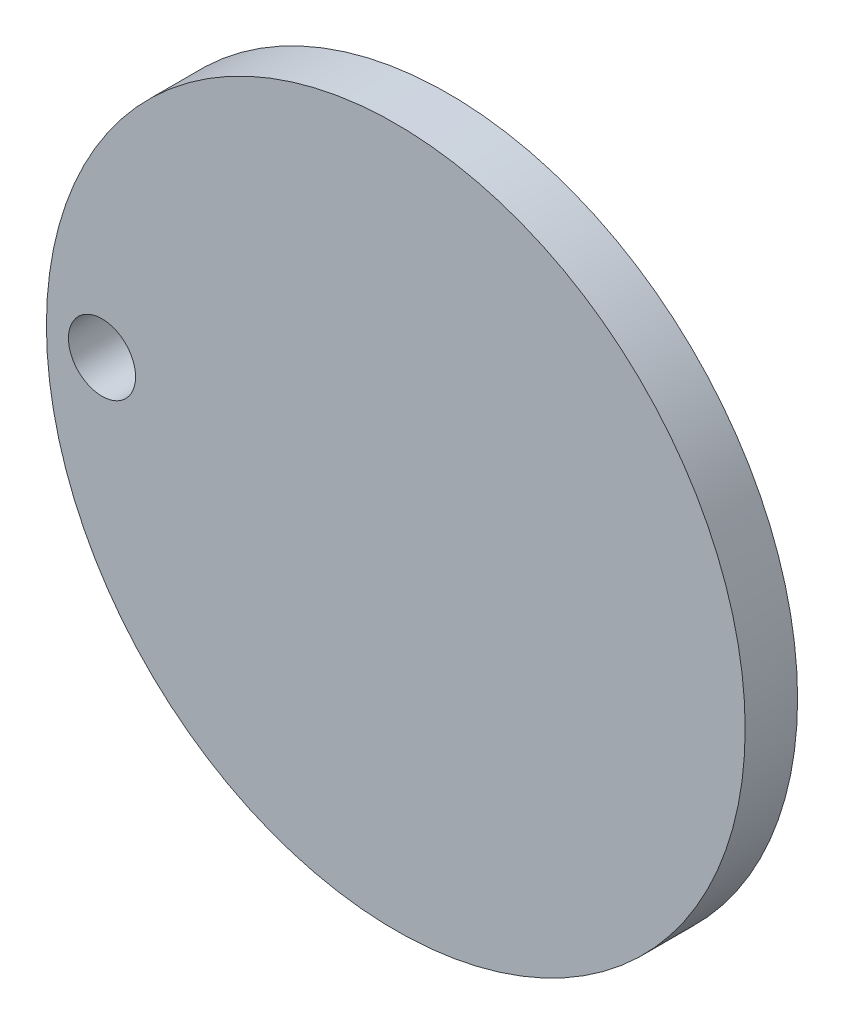
from build123d import *

# Parameters (mm, degrees)
ESQUISSE1_R        = 20
ESQUISSE1_R_2      = 1.921200108
BOSS_EXTRU_1_DEPTH = 3


with BuildPart() as part:
    # Esquisse1 → Boss.-Extru.1 (new body)
    with BuildSketch(Plane.XY):
        Circle(ESQUISSE1_R)
        with Locations((-16.816995958, 0)):
            Circle(ESQUISSE1_R_2, mode=Mode.SUBTRACT)
    extrude(amount=BOSS_EXTRU_1_DEPTH)


solid = part.part
